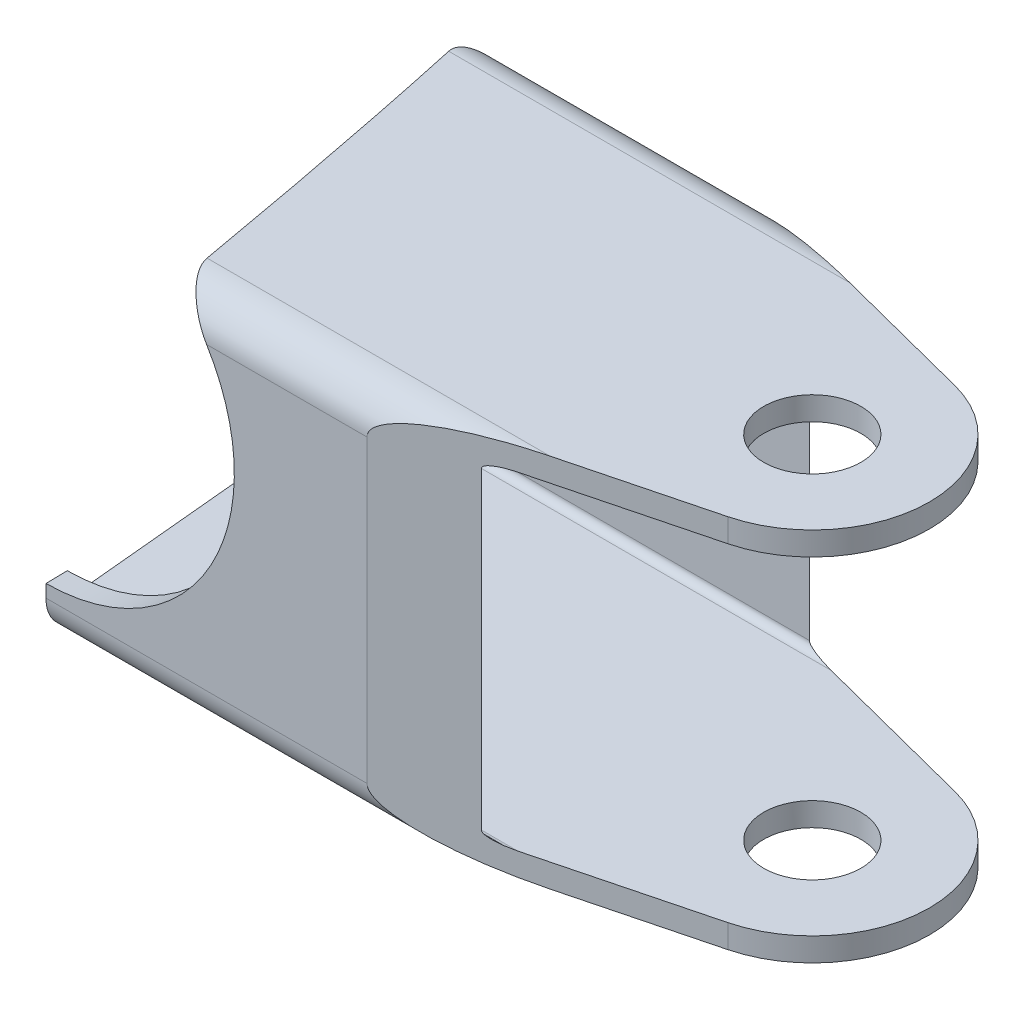
from build123d import *

# Parameters (mm, degrees)
BOSS_EXTRUDE1_DEPTH      = 25.4
BOSS_EXTRUDE1_DEPTH_BACK = 34.925
CUT_EXTRUDE4_DEPTH       = 63.941922635
CUT_EXTRUDE5_DEPTH       = 46.01339384
SKETCH14_R               = 3.2893
CUT_EXTRUDE6_DEPTH       = 46.01339384
CUT_EXTRUDE7_DEPTH       = 56.927898629
CUT_EXTRUDE7_DEPTH_BACK  = 56.927898629
SKETCH15_R               = 12.7
SKETCH16_W               = 56.984020509
SKETCH16_H               = 49.51819964
CUT_EXTRUDE8_DEPTH       = 52.94853237


with BuildPart() as part:
    # Sketch1 → Boss-Extrude1 (new, two sides: drawn at the far end of the back side and taken through both)
    with BuildSketch(Plane(origin=(0, 0, 0), x_dir=(0, 0, -1), z_dir=(1, 0, 0)).offset(-BOSS_EXTRUDE1_DEPTH_BACK)):
        with BuildLine():
            Line((-10.16, 12.7), (10.16, 12.7))
            ThreePointArc((10.16, 12.7), (11.956051224, 11.956051224), (12.7, 10.16))
            Line((12.7, 10.16), (12.7, -10.16))
            ThreePointArc((12.7, -10.16), (11.956051224, -11.956051224), (10.16, -12.7))
            Line((10.16, -12.7), (-10.16, -12.7))
            ThreePointArc((-10.16, -12.7), (-11.956051224, -11.956051224), (-12.7, -10.16))
            Line((-12.7, -10.16), (-12.7, 10.16))
            ThreePointArc((-12.7, 10.16), (-11.956051224, 11.956051224), (-10.16, 12.7))
        make_face()
    extrude(amount=BOSS_EXTRUDE1_DEPTH + BOSS_EXTRUDE1_DEPTH_BACK)

    # Sketch11 → Cut-Extrude4 (cut, through all)
    with BuildSketch(Plane(origin=(25.4, 0, 0), x_dir=(0, 0, -1), z_dir=(1, 0, 0))):
        with BuildLine():
            Line((-10.6045, 11.1125), (10.6045, 11.1125))
            ThreePointArc((10.6045, 11.1125), (10.963710245, 10.963710245), (11.1125, 10.6045))
            Line((11.1125, 10.6045), (11.1125, -10.6045))
            ThreePointArc((11.1125, -10.6045), (10.963710245, -10.963710245), (10.6045, -11.1125))
            Line((10.6045, -11.1125), (-10.6045, -11.1125))
            ThreePointArc((-10.6045, -11.1125), (-10.963710245, -10.963710245), (-11.1125, -10.6045))
            Line((-11.1125, -10.6045), (-11.1125, 10.6045))
            ThreePointArc((-11.1125, 10.6045), (-10.963710245, 10.963710245), (-10.6045, 11.1125))
        make_face()
    extrude(amount=-CUT_EXTRUDE4_DEPTH, mode=Mode.SUBTRACT)

    # Sketch12 → Cut-Extrude5 (cut, through all)
    with BuildSketch(Plane(origin=(0, 12.7, 0), x_dir=(1, 0, 0), z_dir=(0, 1, 0))):
        with BuildLine():
            Line((50.8, 12.7), (0, 12.7))
            Line((0, 12.7), (19.444424463, 7.686083637))
            ThreePointArc((19.444424463, 7.686083637), (25.4, 0), (19.444424463, -7.686083637))
            Line((19.444424463, -7.686083637), (0, -12.7))
            Line((0, -12.7), (50.8, -12.7))
            Line((50.8, -12.7), (50.8, 12.7))
        make_face()
    extrude(amount=-CUT_EXTRUDE5_DEPTH, mode=Mode.SUBTRACT)

    # Sketch14 → Cut-Extrude6 (cut, through all)
    with BuildSketch(Plane(origin=(0, 12.7, 0), x_dir=(1, 0, 0), z_dir=(0, 1, 0))):
        with Locations((17.4625, 0)):
            Circle(SKETCH14_R)
    extrude(amount=-CUT_EXTRUDE6_DEPTH, mode=Mode.SUBTRACT)

    # Sketch15 → Cut-Extrude7 (cut, two sides: drawn at the far end of the back side and taken through both)
    with BuildSketch(Plane(origin=(-21.74366369, 3.432105223, 12.7), x_dir=(-0.9956294808615993, 0.006900458495911943, 0.09313603229582214), z_dir=(-0.09339131029845459, -0.07356465915336341, -0.9929080038374085)).offset(-CUT_EXTRUDE7_DEPTH_BACK)):
        Circle(SKETCH15_R)
    extrude(amount=CUT_EXTRUDE7_DEPTH + CUT_EXTRUDE7_DEPTH_BACK, mode=Mode.SUBTRACT)

    # Sketch16 → Cut-Extrude8 (cut, through all)
    with BuildSketch(Plane(origin=(-22.73705084, 0, 2.138609984), x_dir=(-0.09339131029845457, -0.07356465915336353, -0.9929080038374085), z_dir=(-0.9956056474877124, 0, 0.09364504626819849))):
        with Locations((2.322433733, 0.598462984)):
            Rectangle(SKETCH16_W, SKETCH16_H)
    extrude(amount=CUT_EXTRUDE8_DEPTH, mode=Mode.SUBTRACT)


solid = part.part
